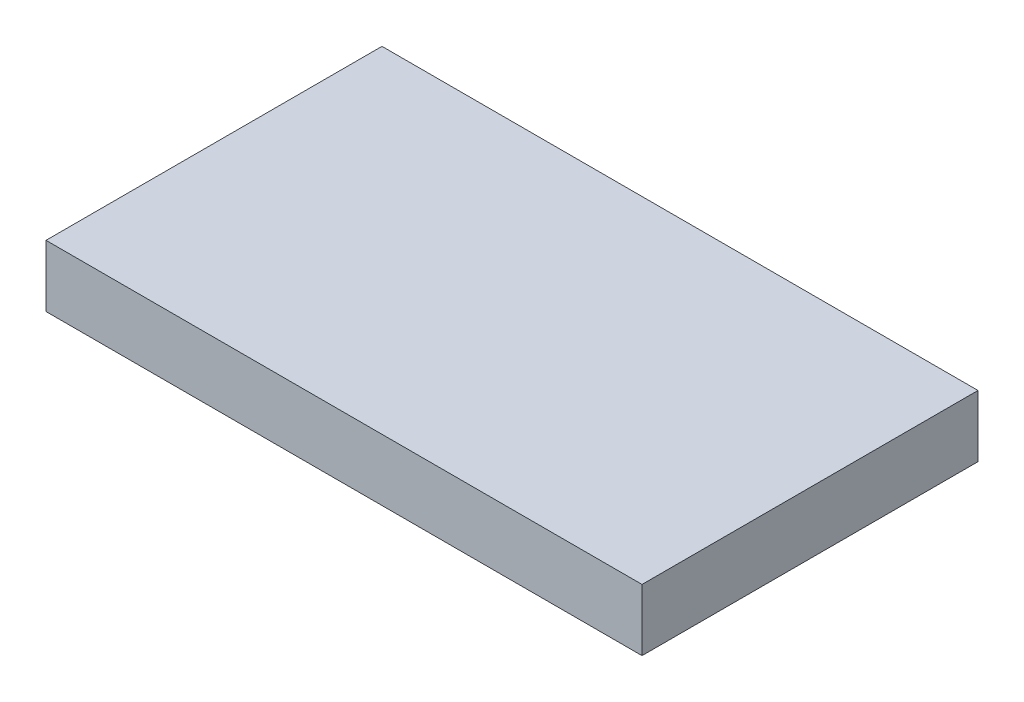
from build123d import *

# Parameters (mm, degrees)
SKETCH1_W           = 31.9024
SKETCH1_H           = 17.9832
BOSS_EXTRUDE1_DEPTH = 3.302


with BuildPart() as part:
    # Sketch1 → Boss-Extrude1 (new body)
    with BuildSketch(Plane(origin=(0, 0, 0), x_dir=(1, 0, 0), z_dir=(0, 1, 0))):
        with Locations((15.9512, 8.9916)):
            Rectangle(SKETCH1_W, SKETCH1_H)
    extrude(amount=BOSS_EXTRUDE1_DEPTH)


solid = part.part
